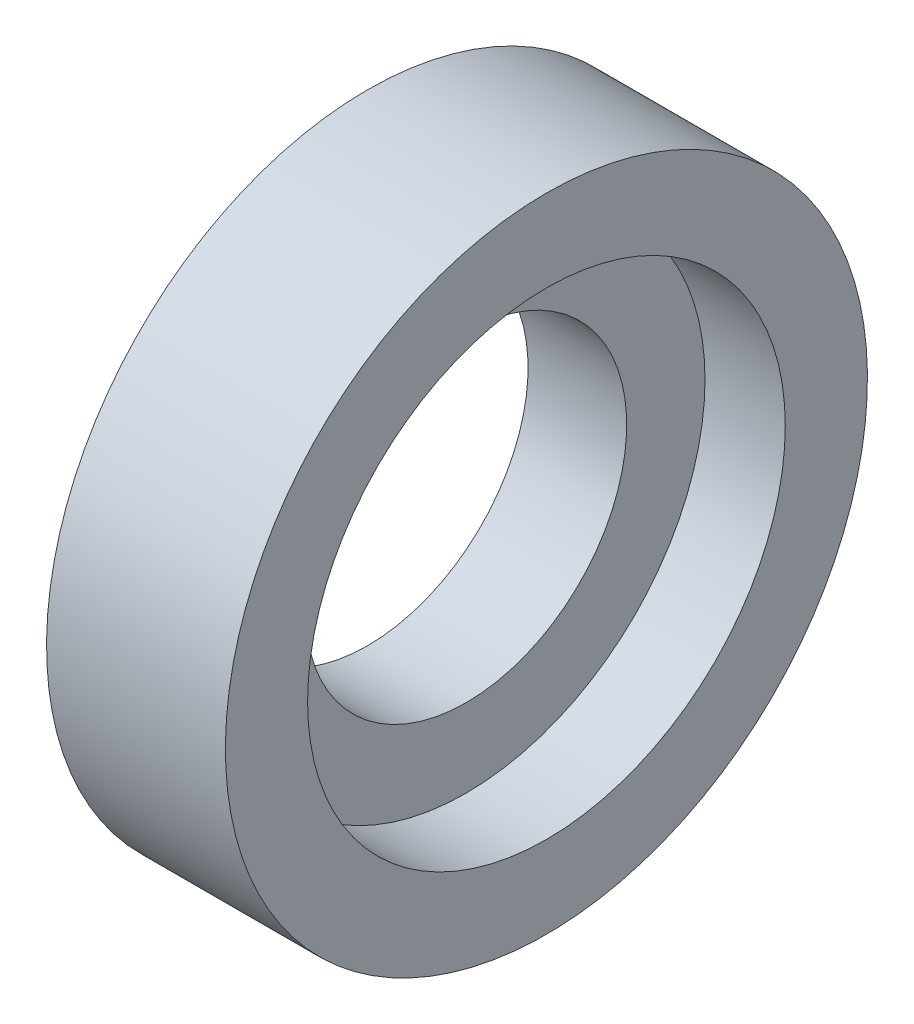
from build123d import *


with BuildPart() as part:
    # Sketch1 → Revolve1 (revolve)
    with BuildSketch(Plane.XY):
        Polygon((0, 9.4488), (0, 6.35), (3.90144, 6.35), (3.90144, 9.4488), (7.07644, 9.4488), (7.07644, 12.7), (0, 12.7), align=None)
    revolve(axis=Axis((3.90144, 0, 0), (-1, 0, 0)))


solid = part.part
